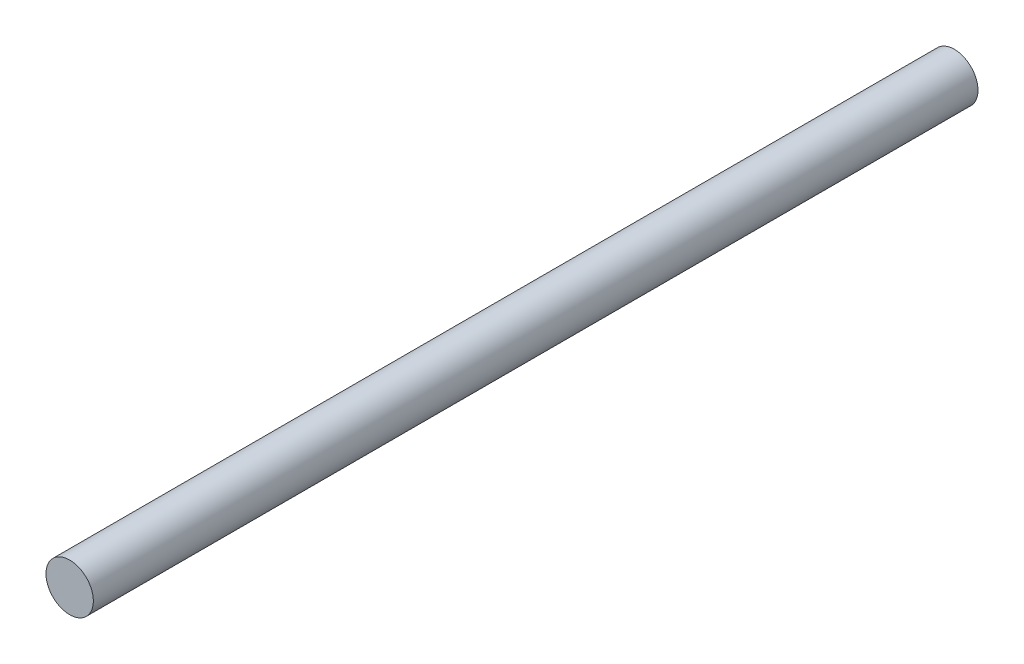
from build123d import *

# Parameters (mm, degrees)
SKETCH2_R           = 15
BOSS_EXTRUDE1_DEPTH = 560


with BuildPart() as part:
    # Sketch2 → Boss-Extrude1 (new body)
    with BuildSketch(Plane.XY):
        Circle(SKETCH2_R)
    extrude(amount=BOSS_EXTRUDE1_DEPTH)


solid = part.part
